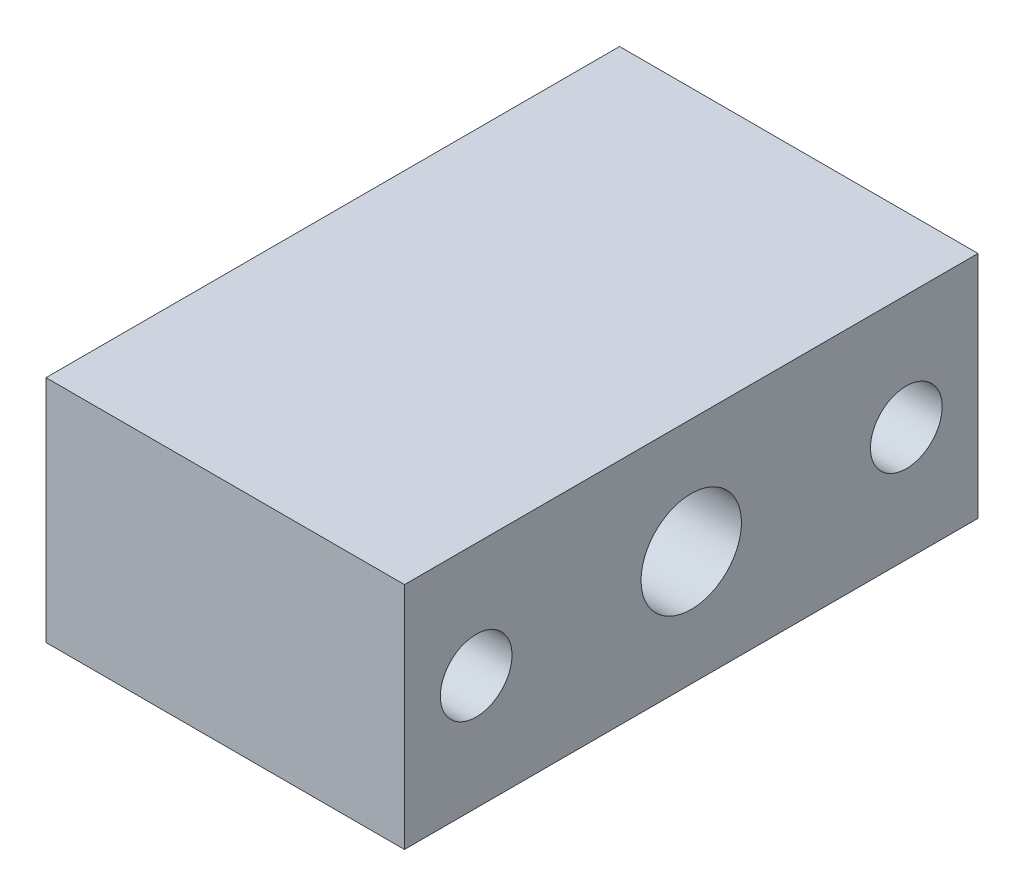
from build123d import *

# Parameters (mm, degrees)
SKETCH_1_W          = 80
SKETCH_1_H          = 32
EXTRUDE_1_DEPTH     = 50
HOLE_WIZARD_M16_1_D = 14
SKETCH_5_R          = 5
CUT_EXTRUDE_1_DEPTH = 67


with BuildPart() as part:
    # 草图1 → 凸台-拉伸1 (new body)
    with BuildSketch(Plane(origin=(0, 0, 0), x_dir=(0, 0, -1), z_dir=(1, 0, 0))):
        Rectangle(SKETCH_1_W, SKETCH_1_H)
    extrude(amount=EXTRUDE_1_DEPTH)

    # M16 螺纹孔1 (through all)
    with Locations(Plane.ZY):
        with Locations((0, 0)):
            Hole(HOLE_WIZARD_M16_1_D / 2)

    # 草图5 → 切除-拉伸1 (cut, through all)
    with BuildSketch(Plane.ZY):
        with Locations((30, 0)):
            Circle(SKETCH_5_R)
    cut_extrude_1 = extrude(amount=-CUT_EXTRUDE_1_DEPTH, mode=Mode.SUBTRACT)

    # 镜向1: 切除-拉伸1 across plane
    add(cut_extrude_1.mirror(Plane.XY), mode=Mode.SUBTRACT)


solid = part.part
